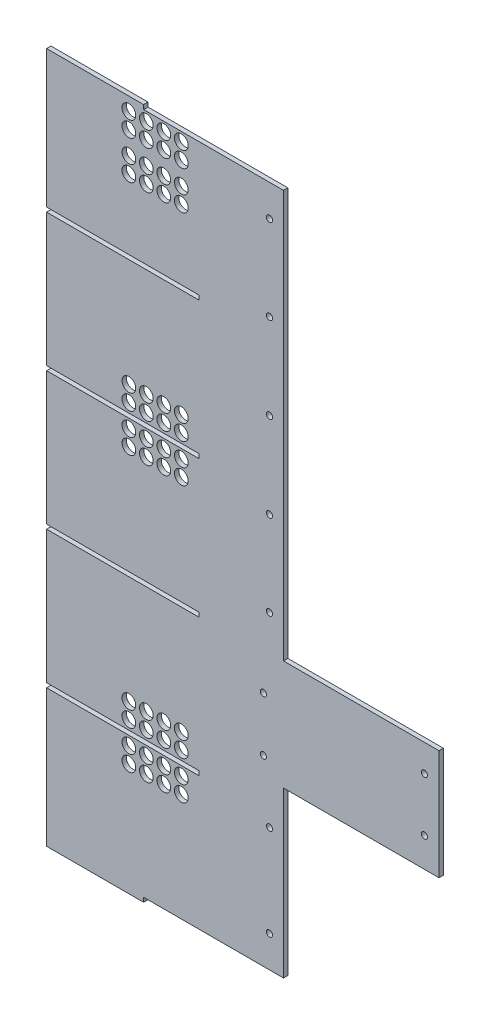
from build123d import *

# Parameters (mm, degrees)
BOSS_EXTRUDE2_DEPTH = 3.175
BOSS_EXTRUDE3_DEPTH = 3.175
BOSS_EXTRUDE6_DEPTH = 3.175
SKETCH8_W           = 70.49262
SKETCH8_H           = 3.175
BOSS_EXTRUDE7_DEPTH = 3.175
SKETCH14_R          = 2.25
CUT_EXTRUDE1_DEPTH  = 371.49176257
SKETCH15_R          = 2.25
CUT_EXTRUDE2_DEPTH  = 371.49176257
SKETCH16_R          = 5
CUT_EXTRUDE3_DEPTH  = 371.49176257


with BuildPart() as part:
    # Sketch1 → Boss-Extrude2 (new body)
    with BuildSketch(Plane.XY):
        Polygon((129.013076168, 254.245404572), (-18.685383832, 254.245404572), (-18.685383832, 157.666984572), (92.088461168, 157.666984572), (92.088461168, 154.491984572), (-18.685383832, 154.491984572), (-18.685383832, 57.913564572), (92.088461168, 57.913564572), (92.088461168, 54.738564572), (-18.685383832, 54.738564572), (-18.685383832, -41.839855428), (92.088461168, -41.839855428), (92.088461168, -45.014855428), (-18.685383832, -45.014855428), (-18.685383832, -141.593275428), (92.088461168, -141.593275428), (92.088461168, -144.768275428), (-18.685383832, -144.768275428), (-18.685383832, -241.346695428), (129.013076168, -241.346695428), align=None)
    extrude(amount=BOSS_EXTRUDE2_DEPTH)

    # Sketch2 → Boss-Extrude3 (add, through all)
    with BuildSketch(Plane.XY.offset(3.175)):
        Polygon((129.013076168, 254.245404572), (129.013076168, -241.346695428), (153.407236168, -241.346695428), (153.407236168, -227.262720585), (153.407236168, -187.892720585), (153.407236168, -143.180775428), (153.407236168, 240.16142973), (153.407236168, 254.245404572), align=None)
    extrude(amount=-BOSS_EXTRUDE3_DEPTH)

    # Sketch7 → Boss-Extrude6 (add, through all)
    with BuildSketch(Plane.XY.offset(3.175)):
        Polygon((153.22938521, -121.781069434), (153.407236168, -41.839855428), (266.437236168, -41.839855428), (266.437236168, -121.781069434), align=None)
    extrude(amount=-BOSS_EXTRUDE6_DEPTH)

    # Sketch8 → Boss-Extrude7 (add, through all)
    with BuildSketch(Plane.XY.offset(3.175)):
        with Locations((16.560926168, 255.832904572)):
            Rectangle(SKETCH8_W, SKETCH8_H)
        with Locations((16.560926168, -242.934195428)):
            Rectangle(SKETCH8_W, SKETCH8_H)
    extrude(amount=-BOSS_EXTRUDE7_DEPTH)

    # Sketch14 → Cut-Extrude1 (cut, through all)
    with BuildSketch(Plane(origin=(0, 0, 0), x_dir=(-1, 0, 0), z_dir=(0, 0, -1))):
        with Locations((-143.247236168, -218.414588646)):
            Circle(SKETCH14_R)
        with Locations((-143.247236168, -151.753275428)):
            Circle(SKETCH14_R)
        with Locations((-255.799716168, -100.445275428)):
            Circle(SKETCH14_R)
        with Locations((-255.799716168, -61.596962209)):
            Circle(SKETCH14_R)
        with Locations((-143.247236168, -16.439855428)):
            Circle(SKETCH14_R)
        with Locations((-143.247236168, 45.232941839)):
            Circle(SKETCH14_R)
        with Locations((-143.247236168, 107.436721182)):
            Circle(SKETCH14_R)
        with Locations((-143.247236168, 169.640500525)):
            Circle(SKETCH14_R)
        with Locations((-143.247236168, 231.313297791)):
            Circle(SKETCH14_R)
    extrude(amount=-CUT_EXTRUDE1_DEPTH, mode=Mode.SUBTRACT)

    # Sketch15 → Cut-Extrude2 (cut, through all)
    with BuildSketch(Plane(origin=(0, 0, 0), x_dir=(-1, 0, 0), z_dir=(0, 0, -1))):
        with Locations((-138.792076168, -108.552320428)):
            Circle(SKETCH15_R)
        with Locations((-138.792076168, -69.242010428)):
            Circle(SKETCH15_R)
    extrude(amount=-CUT_EXTRUDE2_DEPTH, mode=Mode.SUBTRACT)

    # Sketch16 → Cut-Extrude3 (cut, through all)
    with BuildSketch(Plane.XY.offset(3.175)):
        with Locations((79.191467271, 75.975431427)):
            Circle(SKETCH16_R)
        with Locations((66.491467271, 75.975431427)):
            Circle(SKETCH16_R)
        with Locations((53.791467271, 75.975431427)):
            Circle(SKETCH16_R)
        with Locations((41.091467271, 75.975431427)):
            Circle(SKETCH16_R)
        with Locations((66.491467271, 64.545431427)):
            Circle(SKETCH16_R)
        with Locations((53.791467271, 64.545431427)):
            Circle(SKETCH16_R)
        with Locations((41.091467271, 64.545431427)):
            Circle(SKETCH16_R)
        with Locations((79.191467271, 64.545431427)):
            Circle(SKETCH16_R)
        with Locations(Location((41.091467271, 36.676697718, 0), (0, 0, 180))):
            Circle(SKETCH16_R)
        with Locations(Location((41.091467271, 48.106697718, 0), (0, 0, 180))):
            Circle(SKETCH16_R)
        with Locations(Location((53.791467271, 36.676697718, 0), (0, 0, 180))):
            Circle(SKETCH16_R)
        with Locations(Location((53.791467271, 48.106697718, 0), (0, 0, 180))):
            Circle(SKETCH16_R)
        with Locations(Location((66.491467271, 36.676697718, 0), (0, 0, 180))):
            Circle(SKETCH16_R)
        with Locations(Location((66.491467271, 48.106697718, 0), (0, 0, 180))):
            Circle(SKETCH16_R)
        with Locations(Location((79.191467271, 48.106697718, 0), (0, 0, 180))):
            Circle(SKETCH16_R)
        with Locations(Location((79.191467271, 36.676697718, 0), (0, 0, 180))):
            Circle(SKETCH16_R)
        with Locations((79.191467271, -123.531408573)):
            Circle(SKETCH16_R)
        with Locations((66.491467271, -123.531408573)):
            Circle(SKETCH16_R)
        with Locations((53.791467271, -123.531408573)):
            Circle(SKETCH16_R)
        with Locations((41.091467271, -123.531408573)):
            Circle(SKETCH16_R)
        with Locations((66.491467271, -134.961408573)):
            Circle(SKETCH16_R)
        with Locations((53.791467271, -134.961408573)):
            Circle(SKETCH16_R)
        with Locations((41.091467271, -134.961408573)):
            Circle(SKETCH16_R)
        with Locations((79.191467271, -134.961408573)):
            Circle(SKETCH16_R)
        with Locations(Location((41.091467271, -162.830142282, 0), (0, 0, 180))):
            Circle(SKETCH16_R)
        with Locations(Location((41.091467271, -151.400142282, 0), (0, 0, 180))):
            Circle(SKETCH16_R)
        with Locations(Location((53.791467271, -162.830142282, 0), (0, 0, 180))):
            Circle(SKETCH16_R)
        with Locations(Location((53.791467271, -151.400142282, 0), (0, 0, 180))):
            Circle(SKETCH16_R)
        with Locations(Location((66.491467271, -162.830142282, 0), (0, 0, 180))):
            Circle(SKETCH16_R)
        with Locations(Location((66.491467271, -151.400142282, 0), (0, 0, 180))):
            Circle(SKETCH16_R)
        with Locations(Location((79.191467271, -151.400142282, 0), (0, 0, 180))):
            Circle(SKETCH16_R)
        with Locations(Location((79.191467271, -162.830142282, 0), (0, 0, 180))):
            Circle(SKETCH16_R)
        with Locations((79.191467271, 247.687337976)):
            Circle(SKETCH16_R)
        with Locations((66.491467271, 247.687337976)):
            Circle(SKETCH16_R)
        with Locations((53.791467271, 247.687337976)):
            Circle(SKETCH16_R)
        with Locations((41.091467271, 247.687337976)):
            Circle(SKETCH16_R)
        with Locations((66.491467271, 236.257337976)):
            Circle(SKETCH16_R)
        with Locations((53.791467271, 236.257337976)):
            Circle(SKETCH16_R)
        with Locations((41.091467271, 236.257337976)):
            Circle(SKETCH16_R)
        with Locations((79.191467271, 236.257337976)):
            Circle(SKETCH16_R)
        with Locations(Location((41.091467271, 208.388604267, 0), (0, 0, 180))):
            Circle(SKETCH16_R)
        with Locations(Location((41.091467271, 219.818604267, 0), (0, 0, 180))):
            Circle(SKETCH16_R)
        with Locations(Location((53.791467271, 208.388604267, 0), (0, 0, 180))):
            Circle(SKETCH16_R)
        with Locations(Location((53.791467271, 219.818604267, 0), (0, 0, 180))):
            Circle(SKETCH16_R)
        with Locations(Location((66.491467271, 208.388604267, 0), (0, 0, 180))):
            Circle(SKETCH16_R)
        with Locations(Location((66.491467271, 219.818604267, 0), (0, 0, 180))):
            Circle(SKETCH16_R)
        with Locations(Location((79.191467271, 219.818604267, 0), (0, 0, 180))):
            Circle(SKETCH16_R)
        with Locations(Location((79.191467271, 208.388604267, 0), (0, 0, 180))):
            Circle(SKETCH16_R)
    extrude(amount=-CUT_EXTRUDE3_DEPTH, mode=Mode.SUBTRACT)


solid = part.part
